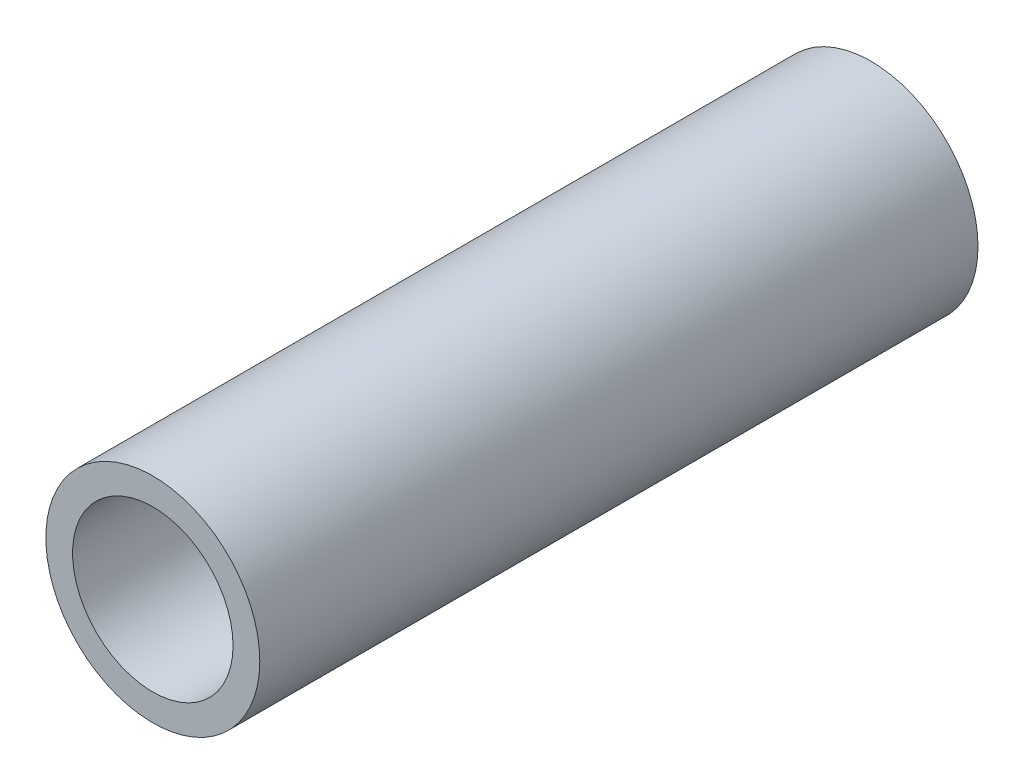
from build123d import *

# Parameters (mm, degrees)
SKETCH1_R           = 4.2
SKETCH1_R_2         = 3.15
BOSS_EXTRUDE1_DEPTH = 28.2


with BuildPart() as part:
    # Sketch1 → Boss-Extrude1 (new body)
    with BuildSketch(Plane.XY):
        Circle(SKETCH1_R)
        Circle(SKETCH1_R_2, mode=Mode.SUBTRACT)
    extrude(amount=BOSS_EXTRUDE1_DEPTH)


solid = part.part
